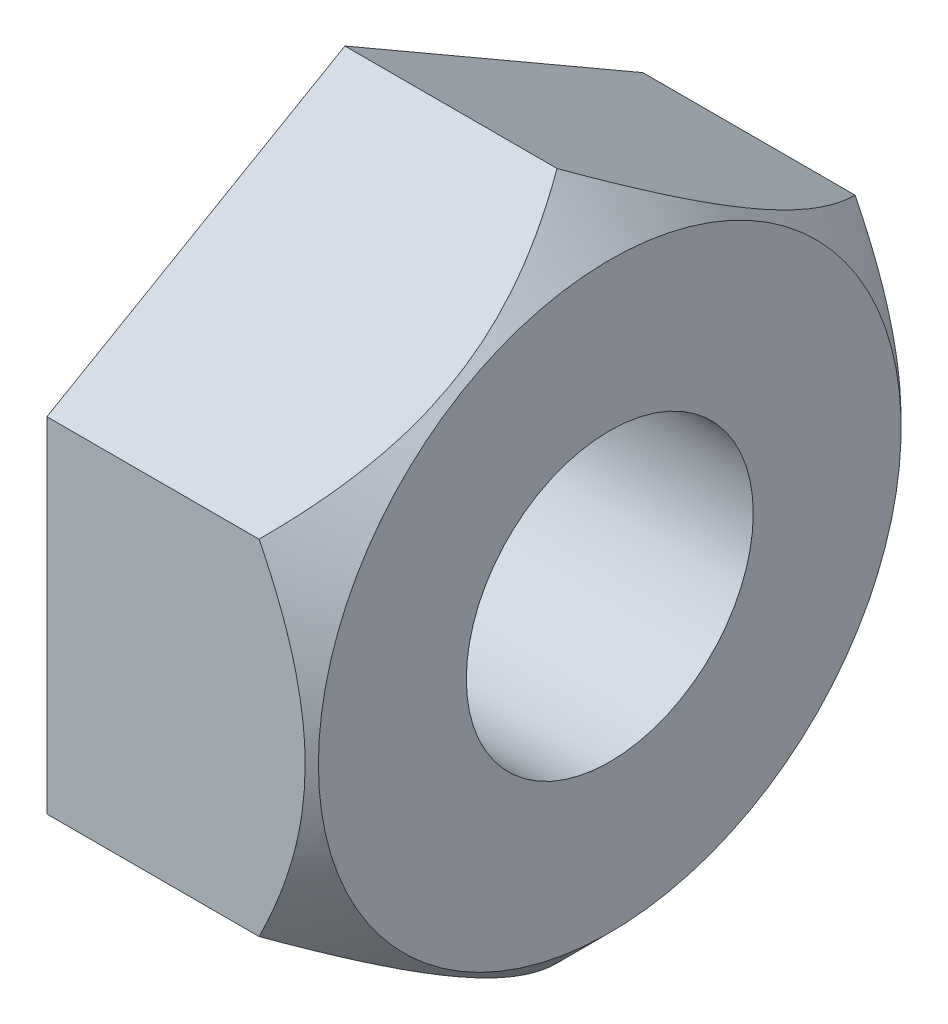
from build123d import *

# Parameters (mm, degrees)
SKETCH2_R          = 27
CUT_EXTRUDE1_DEPTH = 12
SKETCH3_W          = 12
SKETCH3_H          = 6.5


with BuildPart() as part:
    # Sketch1 → Revolve1 (revolve)
    with BuildSketch(Plane.XY, mode=Mode.PRIVATE) as revolve1_sk:
        Polygon((0, 0), (0, 16.2), (9, 16.2), (12, 13.2), (12, 0), align=None)
    revolve(revolve1_sk.sketch.rotate(Axis((12, 0, 0), (-1, 0, 0)), 270), axis=Axis((12, 0, 0), (-1, 0, 0)))

    # Sketch2 → Cut-Extrude1 (cut)
    with BuildSketch(Plane(origin=(0, 0, 0), x_dir=(0, 0, -1), z_dir=(1, 0, 0))):
        Circle(SKETCH2_R)
        Polygon((-13.5, -7.794228634), (0, -15.588457268), (13.5, -7.794228634), (13.5, 7.794228634), (0, 15.588457268), (-13.5, 7.794228634), align=None, mode=Mode.SUBTRACT)
    extrude(amount=CUT_EXTRUDE1_DEPTH, mode=Mode.SUBTRACT)

    # Sketch3 → Cut-Revolve1 (revolve, cut)
    with BuildSketch(Plane.XY, mode=Mode.PRIVATE) as cut_revolve1_sk:
        with Locations((6, 3.25)):
            Rectangle(SKETCH3_W, SKETCH3_H)
    revolve(cut_revolve1_sk.sketch.rotate(Axis((12, 0, 0), (-1, 0, 0)), 270), axis=Axis((12, 0, 0), (-1, 0, 0)), mode=Mode.SUBTRACT)


solid = part.part
